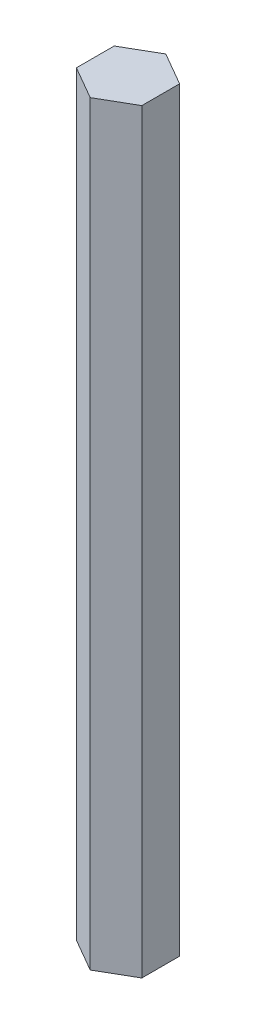
from build123d import *

# Parameters (mm, degrees)
BOSS_EXTRUDE1_DEPTH = 127


with BuildPart() as part:
    # Sketch1 → Boss-Extrude1 (new body)
    with BuildSketch(Plane(origin=(0, 0, 0), x_dir=(1, 0, 0), z_dir=(0, 1, 0))):
        Polygon((0, -6.35), (5.499261314, -3.175), (5.499261314, 3.175), (0, 6.35), (-5.499261314, 3.175), (-5.499261314, -3.175), align=None)
    extrude(amount=BOSS_EXTRUDE1_DEPTH)


solid = part.part
